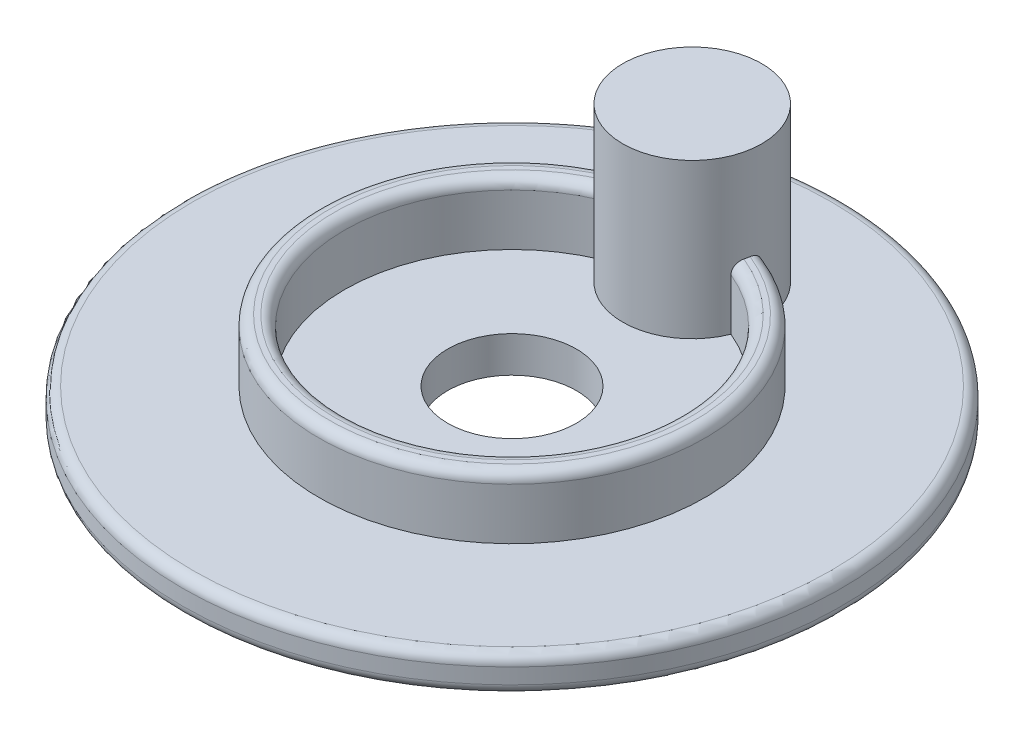
from build123d import *

# Parameters (mm, degrees)
SKETCH1_R           = 64
BOSS_EXTRUDE1_DEPTH = 7
SKETCH2_R           = 37.5
SKETCH2_R_2         = 32.5
BOSS_EXTRUDE2_DEPTH = 12
SKETCH3_R           = 12.5
CUT_EXTRUDE1_DEPTH  = 92.301697684
FILLET1_R           = 2
SKETCH17_R          = 13.5
BOSS_EXTRUDE3_DEPTH = 30


with BuildPart() as part:
    # Sketch1 → Boss-Extrude1 (new body)
    with BuildSketch(Plane(origin=(0, 0, 0), x_dir=(1, 0, 0), z_dir=(0, 1, 0))):
        with Locations(Location((0, 0, 0), (0, 0, 270))):
            Circle(SKETCH1_R)
    extrude(amount=BOSS_EXTRUDE1_DEPTH)

    # Sketch2 → Boss-Extrude2 (add)
    with BuildSketch(Plane(origin=(0, 7, 0), x_dir=(1, 0, 0), z_dir=(0, 1, 0))):
        with Locations(Location((0, 0, 0), (0, 0, 270))):
            Circle(SKETCH2_R)
        with Locations(Location((0, 0, 0), (0, 0, 270))):
            Circle(SKETCH2_R_2, mode=Mode.SUBTRACT)
    extrude(amount=BOSS_EXTRUDE2_DEPTH)

    # Sketch3 → Cut-Extrude1 (cut, through all)
    with BuildSketch(Plane(origin=(0, 7, 0), x_dir=(1, 0, 0), z_dir=(0, 1, 0))):
        with Locations(Location((0, 0, 0), (0, 0, 270))):
            Circle(SKETCH3_R)
    extrude(amount=-CUT_EXTRUDE1_DEPTH, mode=Mode.SUBTRACT)

    # Fillet1
    fillet1_edges = [part.edges().sort_by_distance(p)[0] for p in [
        (0, 0, -64),
        (0, 7, -64),
        (0, 19, -37.5),
        (0, 19, -32.5),
    ]]
    fillet(fillet1_edges, radius=FILLET1_R)

    # Sketch17 → Boss-Extrude3 (add)
    with BuildSketch(Plane(origin=(0, 7, 0), x_dir=(1, 0, 0), z_dir=(0, 1, 0))):
        with Locations(Location((0, 35, 0), (0, 0, 359.939369671))):
            Circle(SKETCH17_R)
    extrude(amount=BOSS_EXTRUDE3_DEPTH)


solid = part.part
